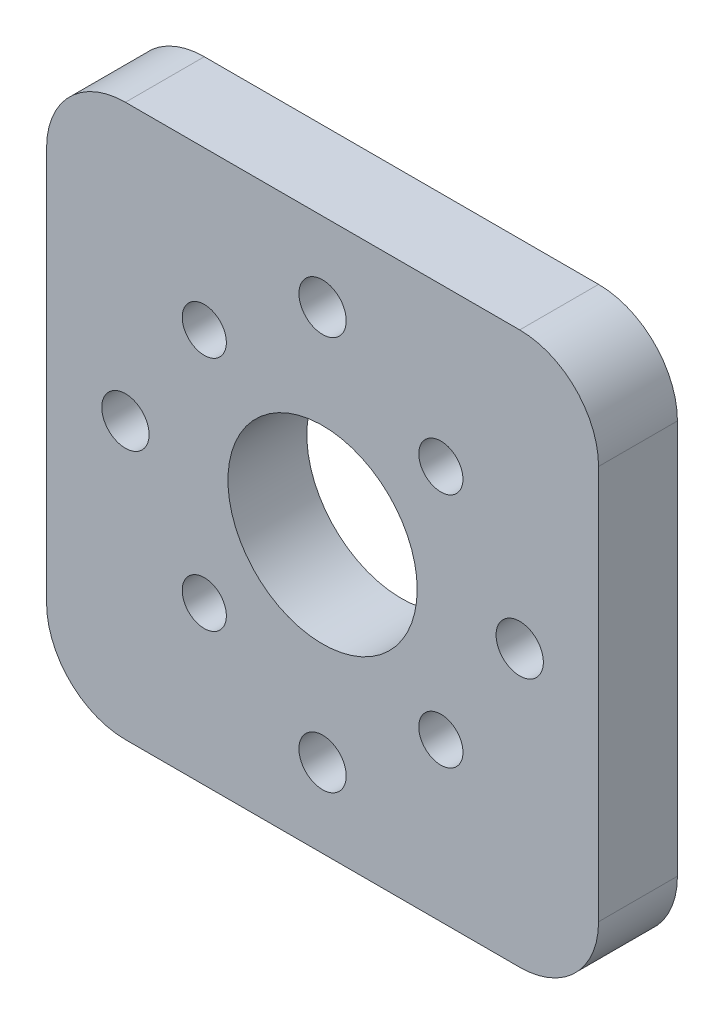
from build123d import *

# Parameters (mm, degrees)
SKETCH_1_W      = 35
SKETCH_1_H      = 35
SKETCH_1_R      = 1.5
SKETCH_1_R_2    = 6
SKETCH_1_R_3    = 1.4
EXTRUDE_1_DEPTH = 5
FILLET_1_R      = 5


with BuildPart() as part:
    # 草图1 → 凸台-拉伸1 (new body)
    with BuildSketch(Plane.XY):
        Rectangle(SKETCH_1_W, SKETCH_1_H)
        with Locations((0, 12.5)):
            Circle(SKETCH_1_R, mode=Mode.SUBTRACT)
        with Locations((12.5, 0)):
            Circle(SKETCH_1_R, mode=Mode.SUBTRACT)
        with Locations((0, -12.5)):
            Circle(SKETCH_1_R, mode=Mode.SUBTRACT)
        with Locations((-12.5, 0)):
            Circle(SKETCH_1_R, mode=Mode.SUBTRACT)
        Circle(SKETCH_1_R_2, mode=Mode.SUBTRACT)
        with Locations((-7.5, 7.5)):
            Circle(SKETCH_1_R_3, mode=Mode.SUBTRACT)
        with Locations((7.5, 7.5)):
            Circle(SKETCH_1_R_3, mode=Mode.SUBTRACT)
        with Locations((7.5, -7.5)):
            Circle(SKETCH_1_R_3, mode=Mode.SUBTRACT)
        with Locations((-7.5, -7.5)):
            Circle(SKETCH_1_R_3, mode=Mode.SUBTRACT)
    extrude(amount=EXTRUDE_1_DEPTH)

    # 圆角1
    fillet_1_edges = [part.edges().sort_by_distance(p)[0] for p in [
        (17.5, -17.5, 2.5),
        (-17.5, -17.5, 2.5),
        (-17.5, 17.5, 2.5),
        (17.5, 17.5, 2.5),
    ]]
    fillet(fillet_1_edges, radius=FILLET_1_R)


solid = part.part
